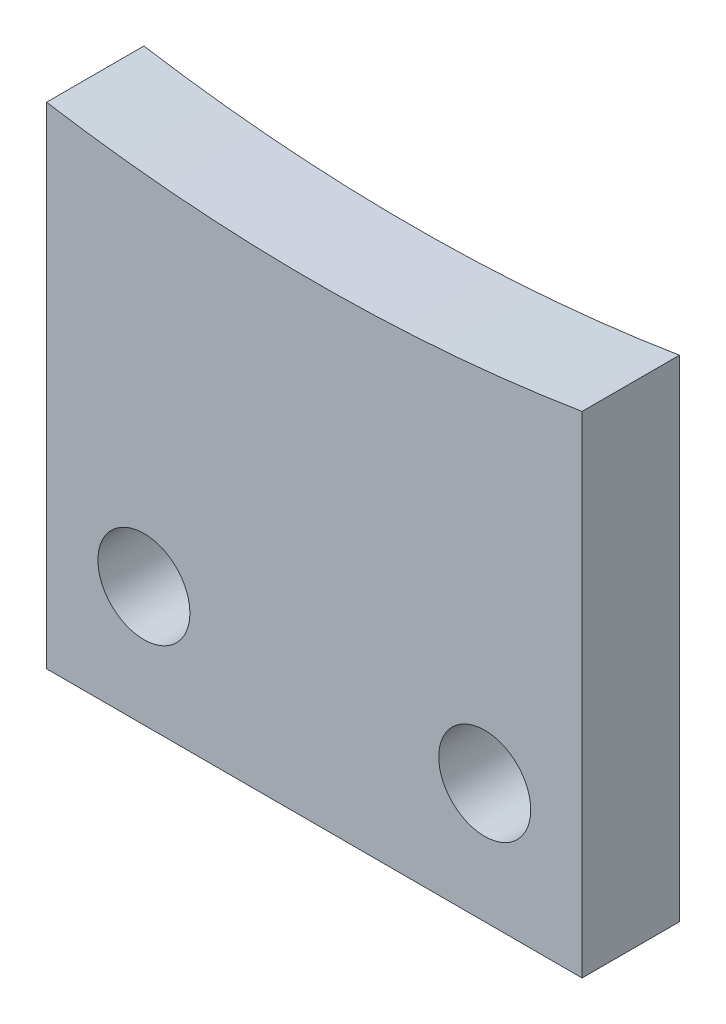
from build123d import *

# Parameters (mm, degrees)
SKETCH1_R           = 1.5
BOSS_EXTRUDE1_DEPTH = 3.175


with BuildPart() as part:
    # Sketch1 → Boss-Extrude1 (new body)
    with BuildSketch(Plane.XY):
        with BuildLine():
            Line((-8.73125, -69.500247016), (0, -69.500247016))
            Line((0, -69.500247016), (8.73125, -69.500247016))
            Line((8.73125, -69.500247016), (8.73125, -53.500247016))
            ThreePointArc((8.73125, -53.500247016), (0, -54.208035911), (-8.73125, -53.500247016))
            Line((-8.73125, -53.500247016), (-8.73125, -69.500247016))
        make_face()
        with Locations((-5.55625, -65.589370266)):
            Circle(SKETCH1_R, mode=Mode.SUBTRACT)
        with BuildLine():
            ThreePointArc((7.05625, -65.589370266), (5.55625, -67.089370266), (4.05625, -65.589370266))
            ThreePointArc((4.05625, -65.589370266), (5.55625, -64.089370266), (7.05625, -65.589370266))
        make_face(mode=Mode.SUBTRACT)
    extrude(amount=BOSS_EXTRUDE1_DEPTH)


solid = part.part
